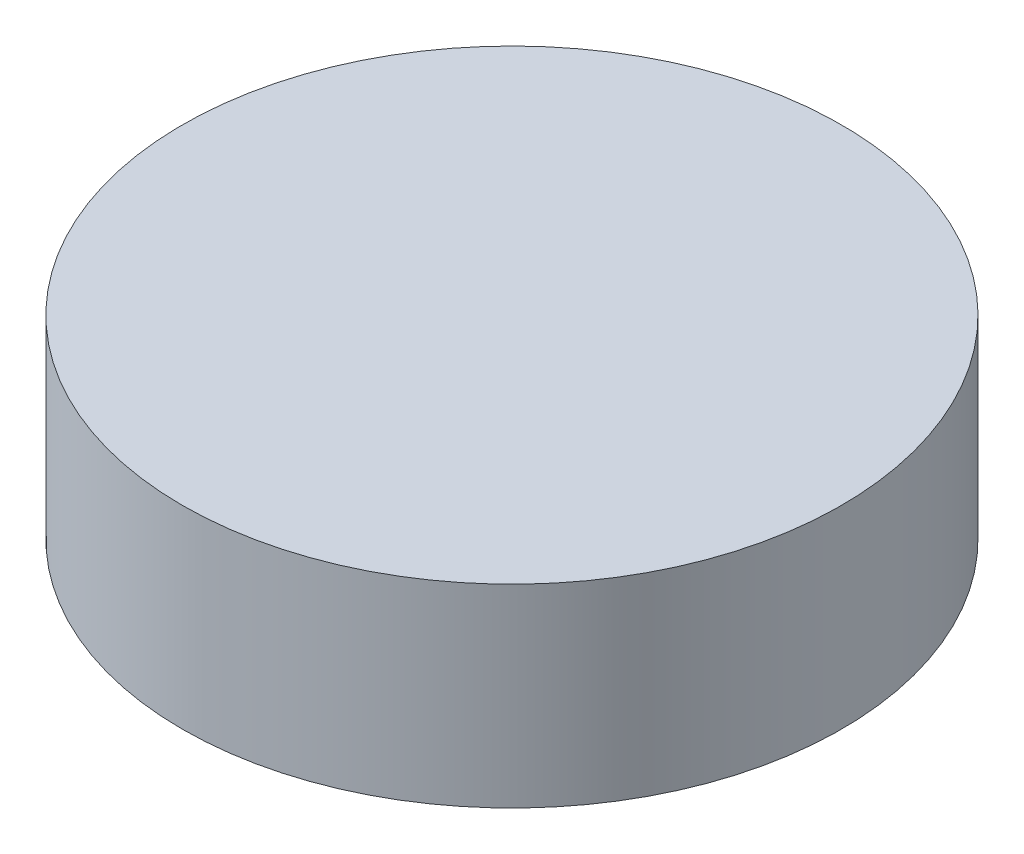
from build123d import *

# Parameters (mm, degrees)
SKETCH1_R           = 10.795
BOSS_EXTRUDE1_DEPTH = 6.35


with BuildPart() as part:
    # Sketch1 → Boss-Extrude1 (new body)
    with BuildSketch(Plane(origin=(0, 0, 0), x_dir=(1, 0, 0), z_dir=(0, 1, 0))):
        with Locations(Location((4.999655882, -4.961936119, 0), (0, 0, 270))):
            Circle(SKETCH1_R)
    extrude(amount=BOSS_EXTRUDE1_DEPTH)


solid = part.part
